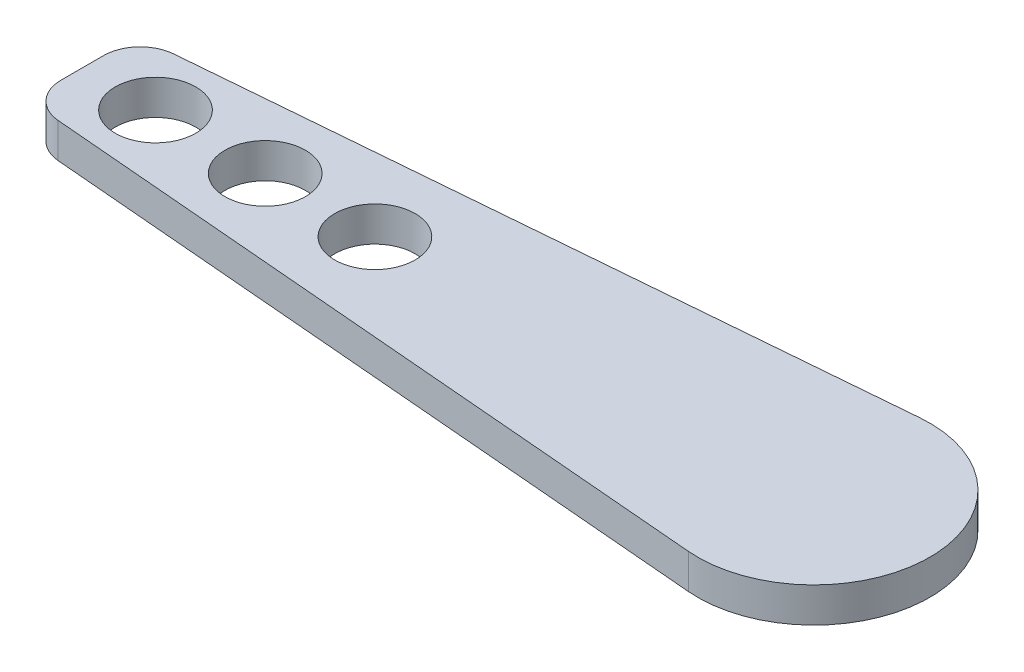
from build123d import *

# Parameters (mm, degrees)
SKETCH2_R           = 5.5
SKETCH2_R_2         = 15.875
BOSS_EXTRUDE1_DEPTH = 4.7625
FILLET1_R           = 5


with BuildPart() as part:
    # Sketch2 → Boss-Extrude1 (new body)
    # profile 1 of 2: a face of its own
    with BuildSketch(Plane(origin=(0, 0, 0), x_dir=(1, 0, 0), z_dir=(0, 1, 0))):
        with BuildLine():
            ThreePointArc((-1.333740348, -15.818873591), (-15.875, -1.13e-07), (-1.333740574, 15.818873572))
            Line((-1.333740574, 15.818873572), (-100, 7.5))
            Line((-100, 7.5), (-100, -7.5))
            Line((-100, -7.5), (-1.333740348, -15.818873591))
        make_face()
        with Locations(Location((-90, 0, 0), (0, 0, 90))):
            Circle(SKETCH2_R, mode=Mode.SUBTRACT)
        with Locations(Location((-75, 0, 0), (0, 0, 90))):
            Circle(SKETCH2_R, mode=Mode.SUBTRACT)
        with Locations(Location((-60, 0, 0), (0, 0, 90))):
            Circle(SKETCH2_R, mode=Mode.SUBTRACT)
    # profile 2 of 2: a face of its own
    with BuildSketch(Plane(origin=(0, 0, 0), x_dir=(1, 0, 0), z_dir=(0, 1, 0))):
        Circle(SKETCH2_R_2)
    extrude(amount=BOSS_EXTRUDE1_DEPTH)

    # Fillet1
    fillet1_edges = [part.edges().sort_by_distance(p)[0] for p in [
        (-100, 2.38125, 7.5),
        (-100, 2.38125, -7.5),
    ]]
    fillet(fillet1_edges, radius=FILLET1_R)


solid = part.part
